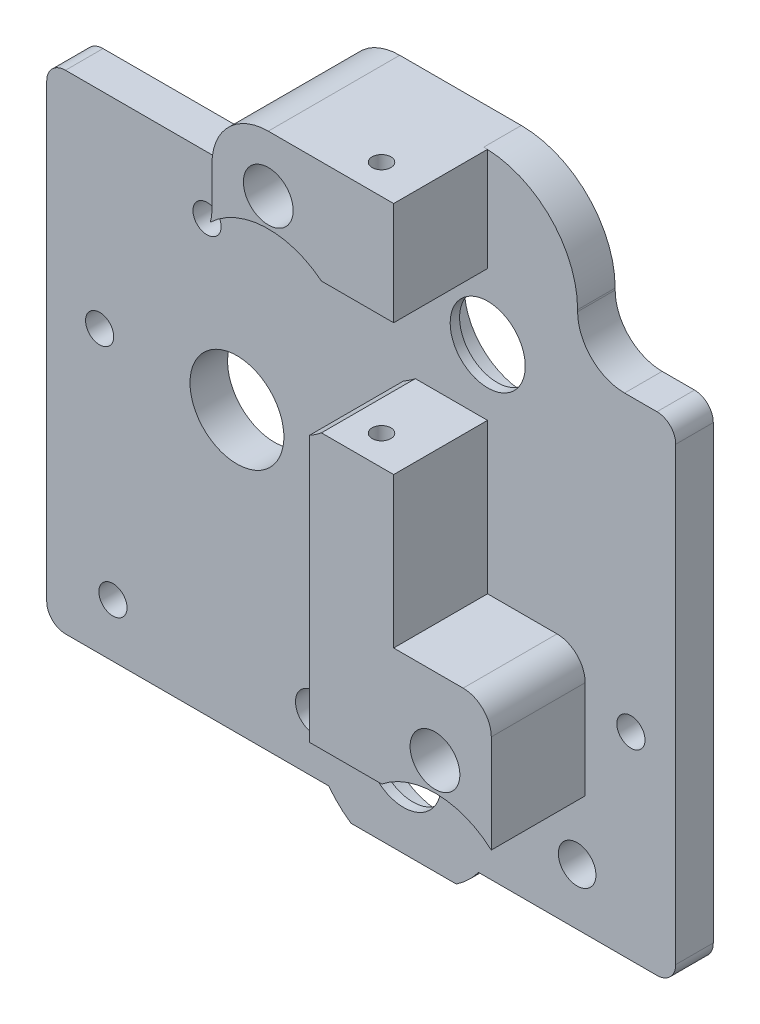
from build123d import *

# Parameters (mm, degrees)
ESBO_O1_R                                       = 2.5
RESSALTO_EXTRUS_O1_DEPTH                        = 4
ESBO_O2_R                                       = 1.5
ESBO_O2_R_2                                     = 5
ESBO_O2_R_3                                     = 4
ESBO_O2_R_4                                     = 2
CORTE_EXTRUS_O1_DEPTH                           = 4
ESBO_O3_R                                       = 6.5
CUT_EXTRUDE1_DEPTH                              = 3
SKETCH1_R                                       = 2.5
BOSS_EXTRUDE1_DEPTH                             = 10
SKETCH2_R                                       = 1
CUT_EXTRUDE3_DEPTH                              = 58
CSK_FOR_M5_FLAT_HEAD_MACHINE_SCREW1_D           = 5.3
CSK_FOR_M5_FLAT_HEAD_MACHINE_SCREW1_CSINK_D     = 10.4
CSK_FOR_M5_FLAT_HEAD_MACHINE_SCREW1_CSINK_ANGLE = 90


with BuildPart() as part:
    # Esboço1 → Ressalto-extrusão1 (new body)
    with BuildSketch(Plane.XY):
        with BuildLine():
            Line((28.048564207, 26.000016667), (31.500000169, 26.000016667))
            ThreePointArc((31.500000169, 26.000016667), (32.914213731, 25.414230229), (33.500000169, 24.000016667))
            Line((33.500000169, 24.000016667), (33.500000169, -24.000016667))
            ThreePointArc((33.500000169, -24.000016667), (32.914213731, -25.414230229), (31.500000169, -26.000016667))
            Line((31.500000169, -26.000016667), (12.499999983, -26.000016667))
            ThreePointArc((12.499999983, -26.000016667), (11.410019713, -27.2255233), (10.134109695, -28.256046043))
            Line((10.134109695, -28.256046043), (-1.094109442, -28.256046043))
            ThreePointArc((-1.094109442, -28.256046043), (-2.37001946, -27.2255233), (-3.45999973, -26.000016667))
            Line((-3.45999973, -26.000016667), (-31.500000169, -26.000016667))
            ThreePointArc((-31.500000169, -26.000016667), (-32.914213731, -25.414230229), (-33.500000169, -24.000016667))
            Line((-33.500000169, -24.000016667), (-33.500000169, 24.000016667))
            ThreePointArc((-33.500000169, 24.000016667), (-32.914213731, 25.414230229), (-31.500000169, 26.000016667))
            Line((-31.500000169, 26.000016667), (-10.901, 26.000016667))
            ThreePointArc((-10.901, 26.000016667), (-7.365466094, 27.464482761), (-5.901, 31.000016667))
            Line((-5.901, 31.000016667), (-5.901, 35.181429851))
            ThreePointArc((-5.901, 35.181429851), (-4.143640687, 39.424070538), (0.099, 41.181429851))
            Line((0.099, 41.181429851), (13.048564207, 41.181429851))
            ThreePointArc((13.048564207, 41.181429851), (20.119632019, 38.252497663), (23.048564207, 31.181429851))
            Line((23.048564207, 31.181429851), (23.048564207, 31.000016667))
            ThreePointArc((23.048564207, 31.000016667), (24.513030301, 27.464482761), (28.048564207, 26.000016667))
        make_face()
        with Locations((0.099, 35.181429851)):
            Circle(ESBO_O1_R, mode=Mode.SUBTRACT)
        with Locations((17.855, -8)):
            Circle(ESBO_O1_R, mode=Mode.SUBTRACT)
    extrude(amount=RESSALTO_EXTRUS_O1_DEPTH)

    # Esboço2 → Corte-extrusão1 (cut)
    with BuildSketch(Plane(origin=(0, 0, 0), x_dir=(-1, 0, 0), z_dir=(0, 0, -1))):
        with Locations((-28.728359433, -4.920628891)):
            Circle(ESBO_O2_R)
        with Locations((16.423325421, 19.853563273)):
            Circle(ESBO_O2_R)
        with Locations((27.863004989, 3.986376213)):
            Circle(ESBO_O2_R)
        with Locations((26.447101695, -20.319132993)):
            Circle(ESBO_O2_R)
        with Locations((13.238926139, 3.805699557)):
            Circle(ESBO_O2_R_2)
        with Locations((-13.474000127, 23.181446518)):
            Circle(ESBO_O2_R_3)
        with Locations((-4.5, -20)):
            Circle(ESBO_O2_R_3)
        with Locations((-23, -20)):
            Circle(ESBO_O2_R_4)
        with Locations((5, -20)):
            Circle(ESBO_O2_R_4)
    extrude(amount=-CORTE_EXTRUS_O1_DEPTH, mode=Mode.SUBTRACT)

    # Esboço3 → Cut-Extrude1 (cut)
    with BuildSketch(Plane(origin=(0, 0, 0), x_dir=(-1, 0, 0), z_dir=(0, 0, -1))):
        with Locations((-13.474000127, 23.181446518)):
            Circle(ESBO_O3_R)
        with Locations((-4.5, -20)):
            Circle(ESBO_O3_R)
    extrude(amount=-CUT_EXTRUDE1_DEPTH, mode=Mode.SUBTRACT)

    # Sketch1 → Boss-Extrude1 (add)
    # profile 1 of 2: a face of its own
    with BuildSketch(Plane.XY.offset(4)):
        with BuildLine():
            Line((13.454, 16.18142986), (13.454, 0.181429851))
            Line((13.454, 0.181429851), (20.855, 0.181429851))
            ThreePointArc((20.855, 0.181429851), (22.976320344, -0.697249805), (23.855, -2.818570149))
            Line((23.855, -2.818570149), (23.855, -13.257131994))
            ThreePointArc((23.855, -13.257131994), (18.073755029, -10.98960381), (12.198145727, -12.999999991))
            Line((12.198145727, -12.999999991), (4.499999978, -12.999999991))
            Line((4.499999978, -12.999999991), (4.499999978, 15.330875804))
            ThreePointArc((4.499999978, 15.330875804), (5.148168847, 15.729461399), (5.76031088, 16.18142986))
            Line((5.76031088, 16.18142986), (13.454, 16.18142986))
        make_face()
        with Locations((17.855, -8)):
            Circle(SKETCH1_R, mode=Mode.SUBTRACT)
    # profile 2 of 2: a face of its own
    with BuildSketch(Plane.XY.offset(4)):
        with BuildLine():
            Line((13.453999976, 41.181429851), (0.099, 41.181429851))
            ThreePointArc((0.099, 41.181429851), (-4.143640687, 39.424070538), (-5.901, 35.181429851))
            Line((-5.901, 35.181429851), (-5.901, 31.000016667))
            ThreePointArc((-5.901, 31.000016667), (-5.944227937, 30.34395972), (-6.073164287, 29.699246768))
            ThreePointArc((-6.073164287, 29.699246768), (-0.248774232, 32.164172288), (5.757624044, 30.183627646))
            Line((5.757624044, 30.183627646), (13.453999976, 30.183627646))
            Line((13.453999976, 30.183627646), (13.453999976, 41.181429851))
        make_face()
        with Locations((0.099, 35.181429851)):
            Circle(SKETCH1_R, mode=Mode.SUBTRACT)
    extrude(amount=BOSS_EXTRUDE1_DEPTH)

    # Sketch2 → Cut-Extrude3 (cut)
    with BuildSketch(Plane(origin=(0, 41.181429851, 0), x_dir=(-1, 0, 0), z_dir=(0, 1, 0))):
        with Locations(Location((-8.993889952, 10.832314202, 0), (0, 0, 90))):
            Circle(SKETCH2_R)
    extrude(amount=-CUT_EXTRUDE3_DEPTH, mode=Mode.SUBTRACT)

    # CSK for M5 Flat Head Machine Screw1 (through all)
    with Locations(Plane(origin=(0, 0, 0), x_dir=(-1, 0, 0), z_dir=(0, 0, -1))):
        with Locations((-0.099, 35.181429851), (-17.855, -8)):
            CounterSinkHole(CSK_FOR_M5_FLAT_HEAD_MACHINE_SCREW1_D / 2, CSK_FOR_M5_FLAT_HEAD_MACHINE_SCREW1_CSINK_D / 2, counter_sink_angle=CSK_FOR_M5_FLAT_HEAD_MACHINE_SCREW1_CSINK_ANGLE)


solid = part.part
